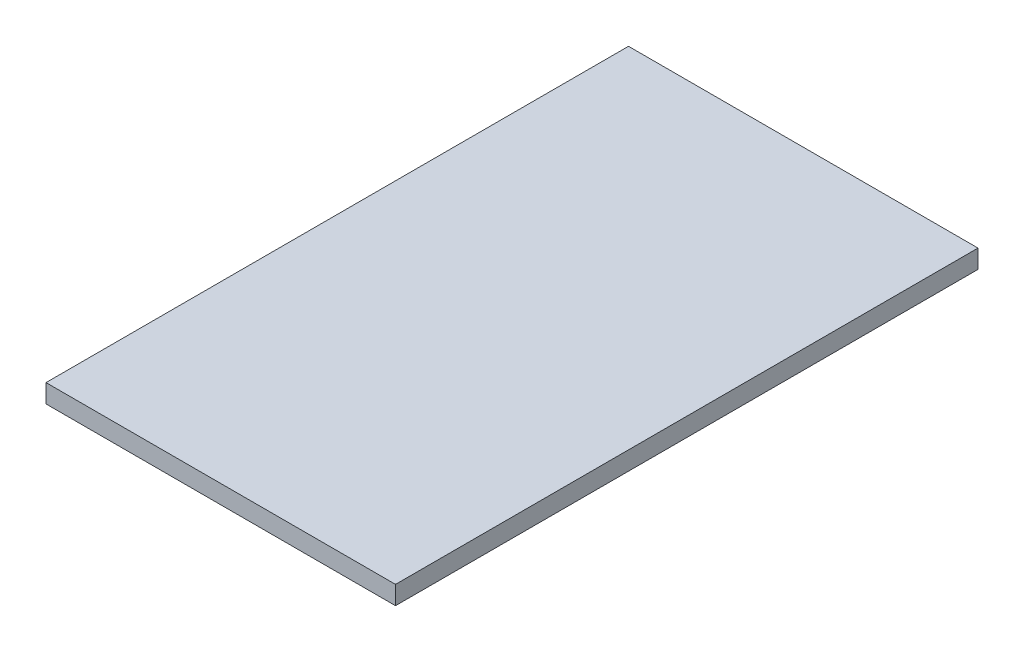
from build123d import *

# Parameters (mm, degrees)
SKETCH1_W           = 30
SKETCH1_H           = 1.5875
BOSS_EXTRUDE1_DEPTH = 50


with BuildPart() as part:
    # Sketch1 → Boss-Extrude1 (new body)
    with BuildSketch(Plane.XY):
        Rectangle(SKETCH1_W, SKETCH1_H)
    extrude(amount=BOSS_EXTRUDE1_DEPTH)


solid = part.part
